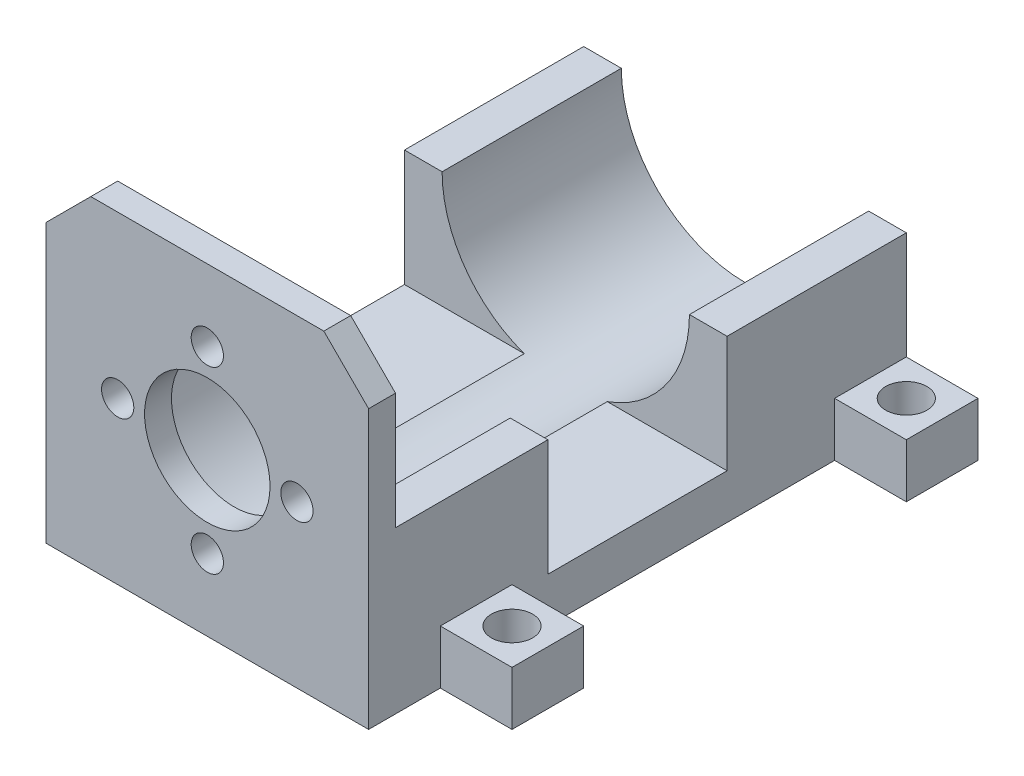
from build123d import *

# Parameters (mm, degrees)
BOSS_EXTRU_1_DEPTH      = 60
ESQUISSE1_3_R           = 1.8
ESQUISSE1_3_R_2         = 7
BOSS_EXTRU_2_DEPTH      = 3
ENL_V_MAT_EXTRU_2_DEPTH = 50
ESQUISSE2_W             = 8
ESQUISSE2_H             = 8
ESQUISSE2_R             = 2.3
BOSS_EXTRU_4_DEPTH      = 6


with BuildPart() as part:
    # Esquisse1 → Boss.-Extru.1 (new body)
    with BuildSketch(Plane.XY):
        with BuildLine():
            ThreePointArc((18, 0), (12.727922061, -12.727922061), (0, -18))
            Line((0, -18), (18, -18))
            Line((18, -18), (18, 0))
        make_face()
        with BuildLine():
            ThreePointArc((0, -18), (-12.727922061, -12.727922061), (-18, 0))
            Line((-18, 0), (-18, -18))
            Line((-18, -18), (0, -18))
        make_face()
        with BuildLine():
            Line((-13.8, 0), (-18, 0))
            ThreePointArc((-18, 0), (-12.727922061, -12.727922061), (0, -18))
            ThreePointArc((0, -18), (12.727922061, -12.727922061), (18, 0))
            Line((18, 0), (13.8, 0))
            ThreePointArc((13.8, 0), (0, -13.8), (-13.8, 0))
        make_face()
    extrude(amount=-BOSS_EXTRU_1_DEPTH)

    # Esquisse1<3> → Boss.-Extru.2 (add)
    with BuildSketch(Plane.XY):
        with BuildLine():
            Line((-13, 18), (-18, 13))
            Line((-18, 13), (-18, 0))
            Line((-18, 0), (-13.8, 0))
            ThreePointArc((-13.8, 0), (0, -13.8), (13.8, 0))
            Line((13.8, 0), (18, 0))
            Line((18, 0), (18, 13))
            Line((18, 13), (13, 18))
            Line((13, 18), (-13, 18))
        make_face()
        with Locations((0, 10)):
            Circle(ESQUISSE1_3_R, mode=Mode.SUBTRACT)
        with Locations((0, -10)):
            Circle(ESQUISSE1_3_R, mode=Mode.SUBTRACT)
        with Locations((-10, 0)):
            Circle(ESQUISSE1_3_R, mode=Mode.SUBTRACT)
        Circle(ESQUISSE1_3_R_2, mode=Mode.SUBTRACT)
        with Locations((10, 0)):
            Circle(ESQUISSE1_3_R, mode=Mode.SUBTRACT)
    extrude(amount=-BOSS_EXTRU_2_DEPTH)

    # Esquisse3 → Enlèv. mat.-Extru.2 (cut)
    with BuildSketch(Plane.ZY.offset(18)):
        Polygon((-30, 0), (-20, 0), (-20, -13), (-40, -13), (-40, 0), align=None)
    extrude(amount=-ENL_V_MAT_EXTRU_2_DEPTH, mode=Mode.SUBTRACT)

    # Esquisse2 → Boss.-Extru.4 (add)
    # profile 1 of 4: a face of its own
    with BuildSketch(Plane.XZ.offset(18)):
        with Locations((22, -56)):
            Rectangle(ESQUISSE2_W, ESQUISSE2_H)
        with Locations(Location((22, -56, 0), (0, 0, 270))):
            Circle(ESQUISSE2_R, mode=Mode.SUBTRACT)
    # profile 2 of 4: a face of its own
    with BuildSketch(Plane.XZ.offset(18)):
        with Locations((-22, -56)):
            Rectangle(ESQUISSE2_W, ESQUISSE2_H)
        with Locations(Location((-22, -56, 0), (0, 0, 270))):
            Circle(ESQUISSE2_R, mode=Mode.SUBTRACT)
    # profile 3 of 4: a face of its own
    with BuildSketch(Plane.XZ.offset(18)):
        with Locations((22, -12)):
            Rectangle(ESQUISSE2_W, ESQUISSE2_H)
        with Locations(Location((22, -12, 0), (0, 0, 270))):
            Circle(ESQUISSE2_R, mode=Mode.SUBTRACT)
    # profile 4 of 4: a face of its own
    with BuildSketch(Plane.XZ.offset(18)):
        with Locations((-22, -12)):
            Rectangle(ESQUISSE2_W, ESQUISSE2_H)
        with Locations(Location((-22, -12, 0), (0, 0, 270))):
            Circle(ESQUISSE2_R, mode=Mode.SUBTRACT)
    extrude(amount=-BOSS_EXTRU_4_DEPTH)


solid = part.part
